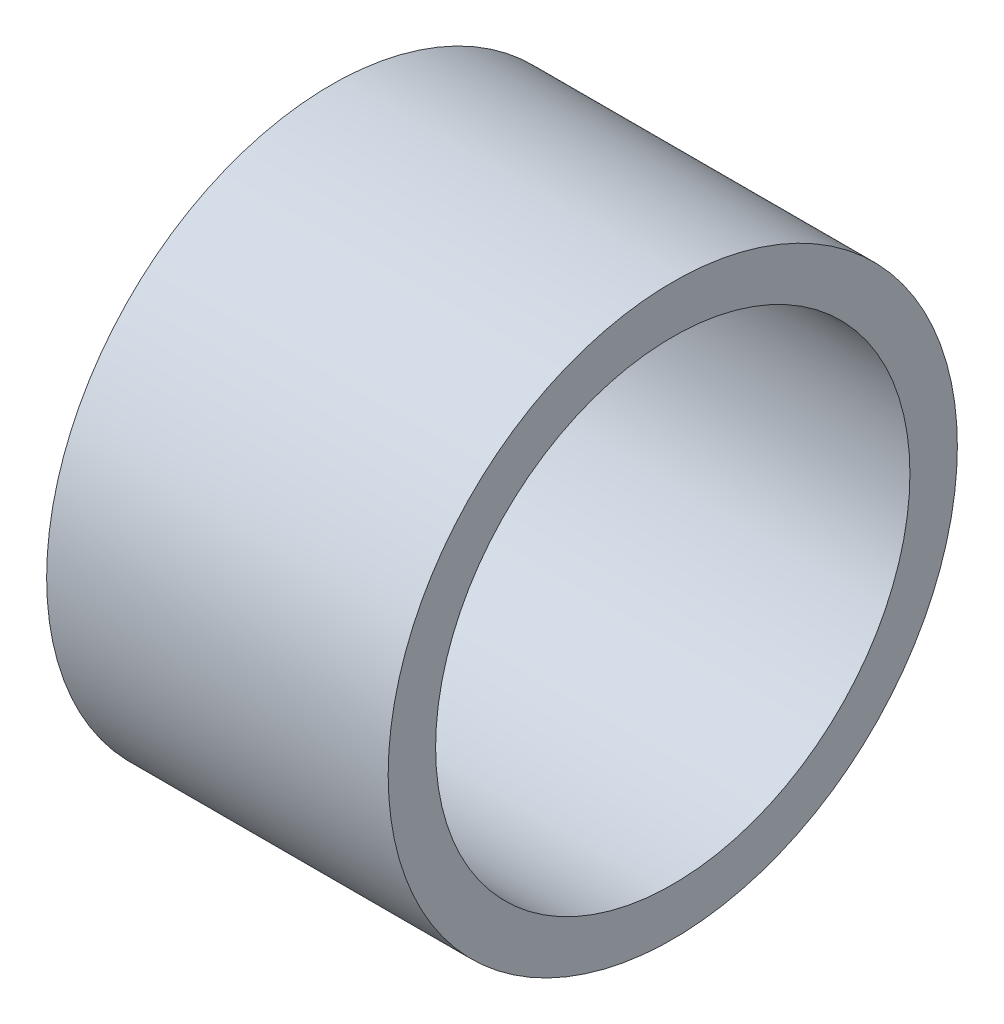
from build123d import *

# Parameters (mm, degrees)
SKETCH2_R           = 9.525
SKETCH2_R_2         = 7.9375
BOSS_EXTRUDE1_DEPTH = 11.43


with BuildPart() as part:
    # Sketch2 → Boss-Extrude1 (new body)
    with BuildSketch(Plane.YZ):
        with Locations(Location((0, 0, 0), (0, 0, 270))):
            Circle(SKETCH2_R)
        with Locations(Location((0, 0, 0), (0, 0, 270))):
            Circle(SKETCH2_R_2, mode=Mode.SUBTRACT)
    extrude(amount=BOSS_EXTRUDE1_DEPTH)


solid = part.part
